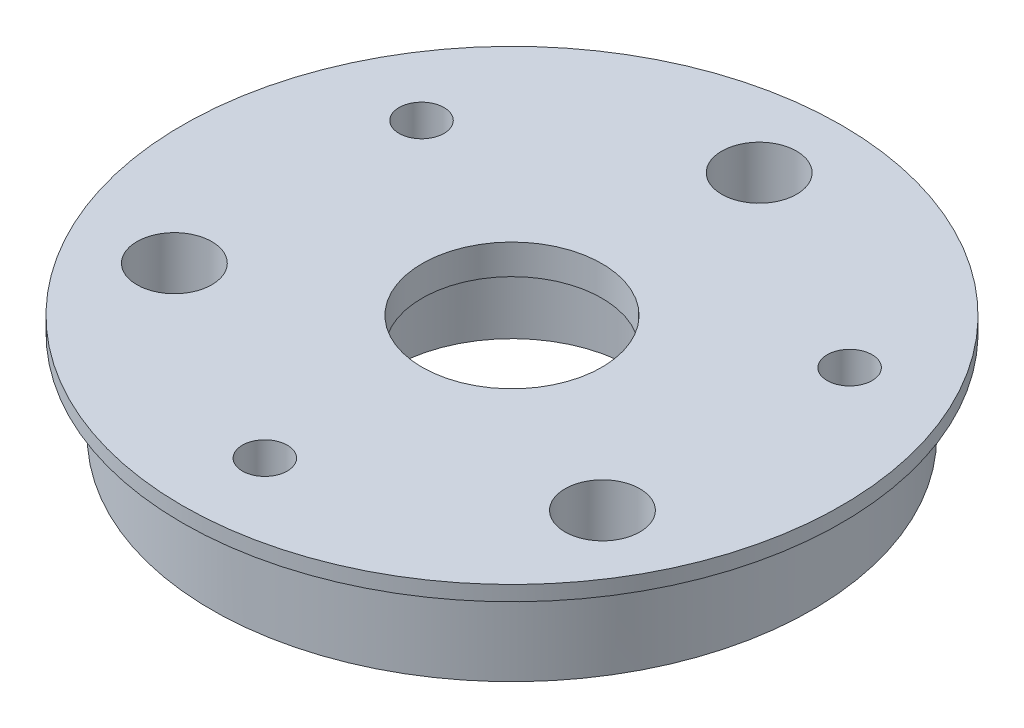
from build123d import *

# Parameters (mm, degrees)
SKETCH1_R           = 20.05
SKETCH1_R_2         = 8
BOSS_EXTRUDE1_DEPTH = 8
SKETCH2_R           = 20.05
SKETCH2_R_2         = 8
SKETCH2_R_3         = 20
BOSS_EXTRUDE2_DEPTH = 7
BOSS_EXTRUDE3_START = -2
SKETCH3_R           = 8
SKETCH3_R_2         = 6
BOSS_EXTRUDE3_DEPTH = 2
SKETCH4_R           = 2.5
SKETCH4_R_2         = 1.5
CUT_EXTRUDE1_DEPTH  = 33.0781078
SKETCH5_R           = 2.5
CUT_EXTRUDE2_DEPTH  = 8
CIRPATTERN1_COUNT   = 3
FILLET1_R           = 2
BOSS_EXTRUDE4_START = -1
SKETCH6_R           = 22
SKETCH6_R_2         = 20.05
BOSS_EXTRUDE4_DEPTH = 1
SKETCH7_R           = 2.5
CUT_EXTRUDE3_DEPTH  = 33.124756808


with BuildPart() as part:
    # Sketch1 → Boss-Extrude1 (new body)
    with BuildSketch(Plane(origin=(0, 0, 0), x_dir=(1, 0, 0), z_dir=(0, 1, 0))):
        with Locations(Location((0, 0, 0), (0, 0, 270))):
            Circle(SKETCH1_R)
        with Locations(Location((0, 0, 0), (0, 0, 270))):
            Circle(SKETCH1_R_2, mode=Mode.SUBTRACT)
    extrude(amount=BOSS_EXTRUDE1_DEPTH)

    # Sketch2 → Boss-Extrude2 (add)
    # profile 1 of 2: a face of its own
    with BuildSketch(Plane(origin=(0, 8, 0), x_dir=(1, 0, 0), z_dir=(0, 1, 0))):
        with Locations(Location((0, 0, 0), (0, 0, 270))):
            Circle(SKETCH2_R)
        with Locations(Location((0, 0, 0), (0, 0, 270))):
            Circle(SKETCH2_R_2, mode=Mode.SUBTRACT)
    # profile 2 of 2: a face of its own
    with BuildSketch(Plane(origin=(0, 8, 0), x_dir=(1, 0, 0), z_dir=(0, 1, 0))):
        with Locations(Location((0, 0, 0), (0, 0, 270))):
            Circle(SKETCH2_R)
        Circle(SKETCH2_R_3, mode=Mode.SUBTRACT)
    extrude(amount=BOSS_EXTRUDE2_DEPTH)

    # Sketch3 → Boss-Extrude3 (add)
    with BuildSketch(Plane(origin=(0, 15, 0), x_dir=(1, 0, 0), z_dir=(0, 1, 0)).offset(BOSS_EXTRUDE3_START)):
        with Locations(Location((0, 0, 0), (0, 0, 270))):
            Circle(SKETCH3_R)
        with Locations(Location((0, 0, 0), (0, 0, 270))):
            Circle(SKETCH3_R_2, mode=Mode.SUBTRACT)
    extrude(amount=BOSS_EXTRUDE3_DEPTH)

    # Sketch4 → Cut-Extrude1 (cut, through all)
    with BuildSketch(Plane(origin=(0, 15, 0), x_dir=(1, 0, 0), z_dir=(0, 1, 0))):
        with Locations(Location((0, 16.5, 0), (0, 0, 270))):
            Circle(SKETCH4_R)
        with Locations(Location((14.289419162, -8.25, 0), (0, 0, 270))):
            Circle(SKETCH4_R)
        with Locations(Location((-14.289419162, -8.25, 0), (0, 0, 270))):
            Circle(SKETCH4_R)
        with Locations(Location((0, -16.5, 0), (0, 0, 270))):
            Circle(SKETCH4_R_2)
        with Locations(Location((-14.289419162, 8.25, 0), (0, 0, 270))):
            Circle(SKETCH4_R_2)
        with Locations(Location((14.289419162, 8.25, 0), (0, 0, 270))):
            Circle(SKETCH4_R_2)
    extrude(amount=-CUT_EXTRUDE1_DEPTH, mode=Mode.SUBTRACT)

    # Sketch5 → Cut-Extrude2 (cut)
    with BuildSketch(Plane.XZ):
        with BuildLine():
            ThreePointArc((-3.332922817, 7.272662889), (-2.919714264, 7.448172166), (-2.497311128, 7.600226124))
            Line((-2.497311128, 7.600226124), (-6.258886015, 19.048066722))
            ThreePointArc((-6.258886015, 19.048066722), (-7.661105353, 18.52862555), (-9.020711712, 17.906123539))
            ThreePointArc((-9.020711712, 17.906123539), (-17.363809346, 10.025), (-20.017513724, -1.140896267))
            ThreePointArc((-20.017513724, -1.140896267), (-19.8768131, -2.629600918), (-19.625552682, -4.103679072))
            Line((-19.625552682, -4.103679072), (-7.830644462, -1.637378184))
            ThreePointArc((-7.830644462, -1.637378184), (-7.91016344, -1.195539359), (-7.964772223, -0.749935616))
            ThreePointArc((-7.964772223, -0.749935616), (-6.92820323, 4), (-3.332922817, 7.272662889))
        make_face()
        with Locations(Location((-14.289419162, 8.25, 0), (0, 0, 90))):
            Circle(SKETCH5_R, mode=Mode.SUBTRACT)
    cut_extrude2 = extrude(amount=-CUT_EXTRUDE2_DEPTH, mode=Mode.SUBTRACT)

    # CirPattern1: Cut-Extrude2 ×3 about axis
    cirpattern1_axis = Axis((0, 0, 0), (0, 1, 0))
    for i in range(1, CIRPATTERN1_COUNT):
        add(cut_extrude2.rotate(cirpattern1_axis, i * 360 / CIRPATTERN1_COUNT), mode=Mode.SUBTRACT)

    # Fillet1
    fillet1_edges = [part.edges().sort_by_distance(p)[0] for p in [
        (-7.830644462, 4, -1.637378184),
        (-19.625552682, 4, -4.103679072),
        (-6.258886015, 4, 19.048066722),
        (-2.497311128, 4, 7.600226124),
        (2.497311128, 4, 7.600226124),
        (6.258886015, 4, 19.048066722),
        (19.625552682, 4, -4.103679072),
        (7.830644462, 4, -1.637378184),
        (5.333333333, 4, -5.96284794),
        (13.366666667, 4, -14.94438765),
        (-13.366666667, 4, -14.94438765),
        (-5.333333333, 4, -5.96284794),
    ]]
    fillet(fillet1_edges, radius=FILLET1_R)

    # Sketch6 → Boss-Extrude4 (add)
    with BuildSketch(Plane(origin=(0, 15, 0), x_dir=(1, 0, 0), z_dir=(0, 1, 0)).offset(BOSS_EXTRUDE4_START)):
        with Locations(Location((0, 0, 0), (0, 0, 270))):
            Circle(SKETCH6_R)
        with Locations(Location((0, 0, 0), (0, 0, 41.828059361))):
            Circle(SKETCH6_R_2, mode=Mode.SUBTRACT)
    extrude(amount=BOSS_EXTRUDE4_DEPTH)

    # Sketch7 → Cut-Extrude3 (cut, through all)
    # profile 1 of 2: a face of its own
    with BuildSketch(Plane.XZ.offset(-8)):
        with BuildLine():
            ThreePointArc((4.109756896, 19.624280834), (5.43201172, 18.666478367), (5.599862615, 17.042418804))
            Line((5.599862615, 17.042418804), (3.058568997, 9.308337966))
            ThreePointArc((3.058568997, 9.308337966), (2.235430366, 8.247362264), (0.926809973, 7.946132599))
            ThreePointArc((0.926809973, 7.946132599), (6.92820323, 4), (7.344957679, -3.170425319))
            ThreePointArc((7.344957679, -3.170425319), (8.260140418, -2.187741646), (9.590541644, -2.005370533))
            Line((9.590541644, -2.005370533), (17.559098934, -3.67158612))
            ThreePointArc((17.559098934, -3.67158612), (18.881650325, -4.62897904), (19.050004181, -6.252986541))
            ThreePointArc((19.050004181, -6.252986541), (17.363809346, 10.025), (4.109756896, 19.624280834))
        make_face()
        with Locations(Location((14.289419162, 8.25, 0), (0, 0, 90))):
            Circle(SKETCH7_R, mode=Mode.SUBTRACT)
    # profile 2 of 2: a face of its own
    with BuildSketch(Plane.XZ.offset(-8)):
        with BuildLine():
            ThreePointArc((5.599862615, 17.042418804), (5.43201172, 18.666478367), (4.109756896, 19.624280834))
            ThreePointArc((4.109756896, 19.624280834), (-17.363809346, -10.025), (19.050004181, -6.252986541))
            ThreePointArc((19.050004181, -6.252986541), (18.881650325, -4.62897904), (17.559098934, -3.67158612))
            Line((17.559098934, -3.67158612), (9.590541644, -2.005370533))
            ThreePointArc((9.590541644, -2.005370533), (8.260140418, -2.187741646), (7.344957679, -3.170425319))
            ThreePointArc((7.344957679, -3.170425319), (-6.92820323, -4), (0.926809973, 7.946132599))
            ThreePointArc((0.926809973, 7.946132599), (2.235430366, 8.247362264), (3.058568997, 9.308337966))
            Line((3.058568997, 9.308337966), (5.599862615, 17.042418804))
        make_face()
    extrude(amount=CUT_EXTRUDE3_DEPTH, mode=Mode.SUBTRACT)


solid = part.part
